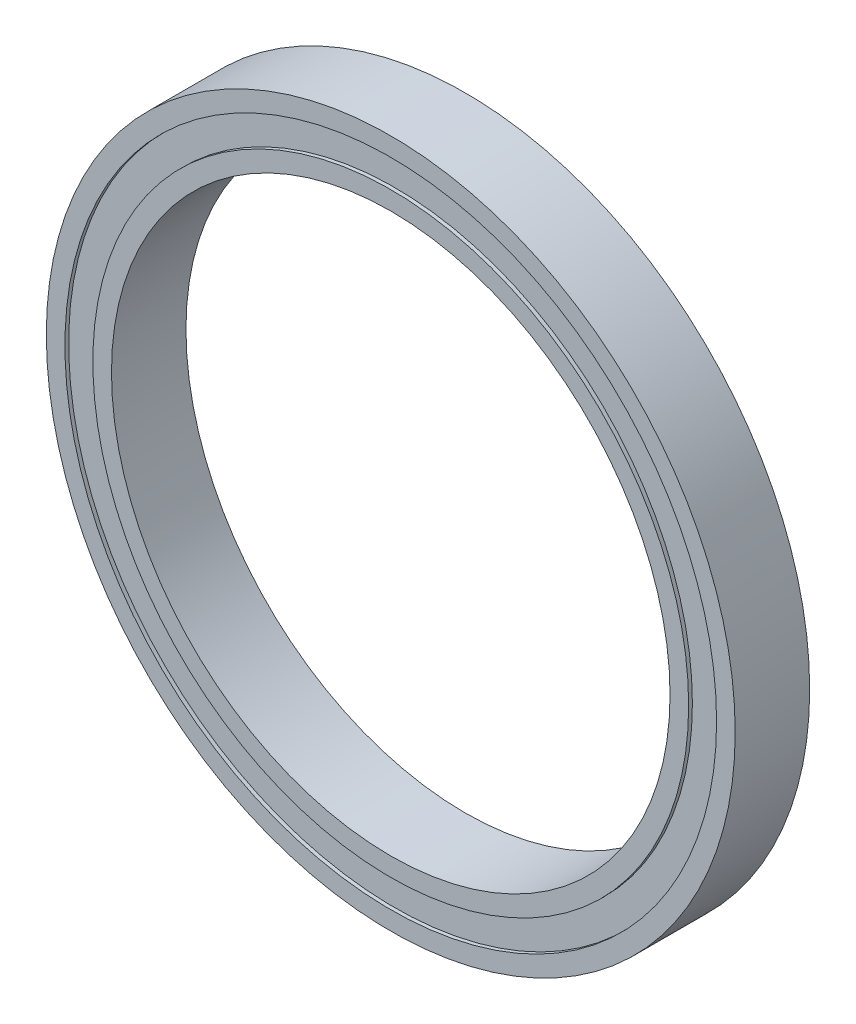
from build123d import *


with BuildPart() as part:
    # 草图2 → 旋转1 (revolve)
    with BuildSketch(Plane(origin=(0, 0, 0), x_dir=(1, 0, 0), z_dir=(0, 1, 0))):
        Polygon((16, 2), (16, 1.8), (17.5, 1.8), (17.5, 2), (18.5, 2), (18.5, -2), (17.5, -2), (17.5, -1.8), (16, -1.8), (16, -2), (15, -2), (15, 2), align=None)
    revolve(axis=Axis((0, 0, 426.054329645), (0, 0, -1)))


solid = part.part
